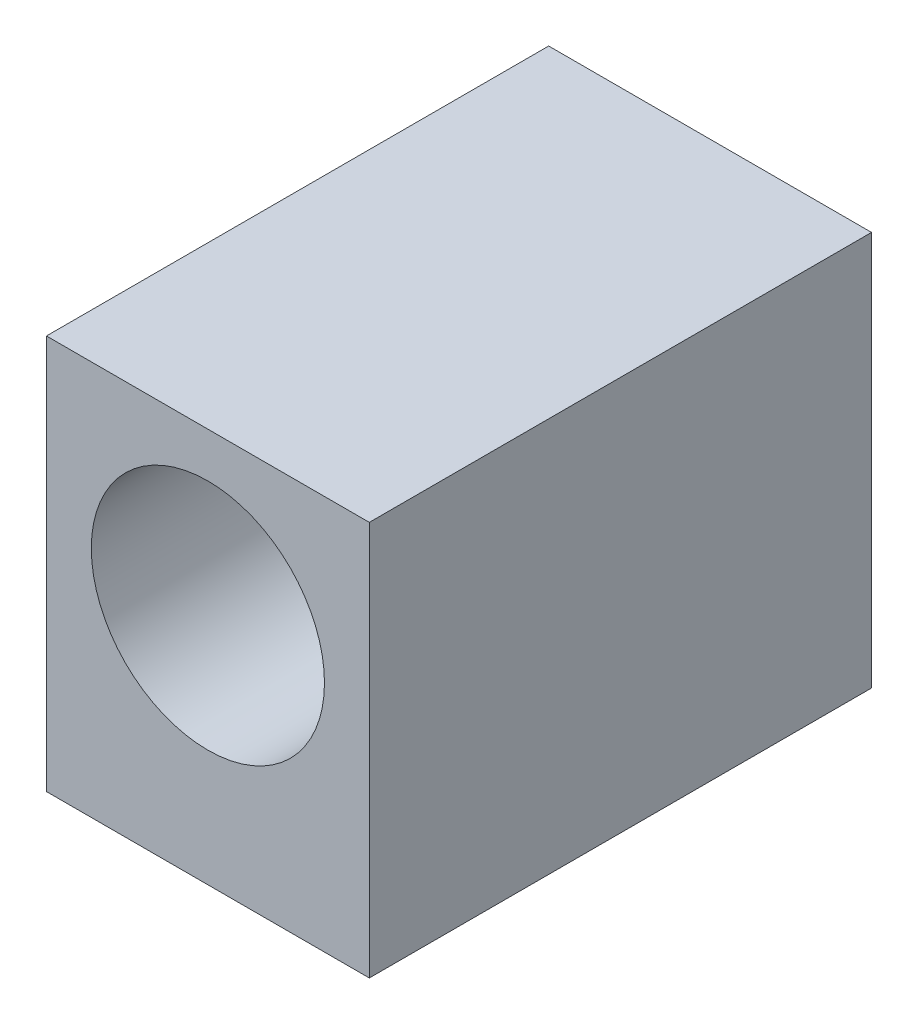
from build123d import *

# Parameters (mm, degrees)
SKETCH1_W           = 9
SKETCH1_H           = 14
BOSS_EXTRUDE1_DEPTH = 11
SKETCH2_R           = 3.25
CUT_EXTRUDE1_DEPTH  = 9


with BuildPart() as part:
    # Sketch1 → Boss-Extrude1 (new body)
    with BuildSketch(Plane(origin=(0, 0, 0), x_dir=(1, 0, 0), z_dir=(0, 1, 0))):
        with Locations((4.5, 7)):
            Rectangle(SKETCH1_W, SKETCH1_H)
    extrude(amount=BOSS_EXTRUDE1_DEPTH)

    # Sketch2 → Cut-Extrude1 (cut)
    with BuildSketch(Plane.XY):
        with Locations((4.5, 6.5)):
            Circle(SKETCH2_R)
    extrude(amount=-CUT_EXTRUDE1_DEPTH, mode=Mode.SUBTRACT)


solid = part.part
